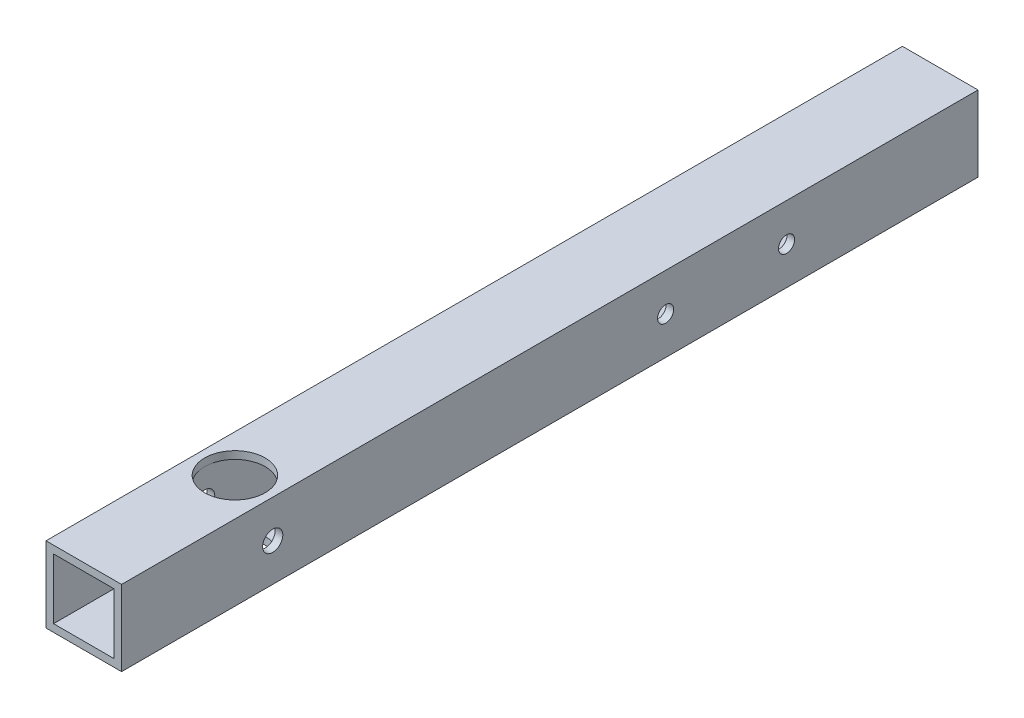
from build123d import *

# Parameters (mm, degrees)
SKETCH_1_W               = 15
SKETCH_1_H               = 15
SKETCH_1_W_2             = 12
SKETCH_1_H_2             = 12
EXTRUDE_1_DEPTH          = 160
SKETCH_3_R               = 6
CUT_EXTRUDE_3_DEPTH      = 161.876505432
SKETCH_7_R               = 2
CUT_EXTRUDE_4_DEPTH      = 161.876505432
CUT_EXTRUDE_5_DEPTH      = 161.876505432
CUT_EXTRUDE_5_DEPTH_BACK = 161.876505432
SKETCH_12_R              = 1.6
SKETCH_13_W              = 15
SKETCH_13_H              = 15
SKETCH_13_W_2            = 12
SKETCH_13_H_2            = 12
EXTRUDE_1_2_DEPTH        = 10


with BuildPart() as part:
    # ｽｹｯﾁ1 → Extrude 1 (new body)
    with BuildSketch(Plane.XY):
        Rectangle(SKETCH_1_W, SKETCH_1_H)
        Rectangle(SKETCH_1_W_2, SKETCH_1_H_2, mode=Mode.SUBTRACT)
    extrude(amount=EXTRUDE_1_DEPTH)

    # ｽｹｯﾁ3 → ｶｯﾄ - 押し出し3 (cut, through all)
    with BuildSketch(Plane.XZ.offset(7.5)):
        with Locations(Location((0, 140, 0), (0, 0, 180))):
            Circle(SKETCH_3_R)
    extrude(amount=-CUT_EXTRUDE_3_DEPTH, mode=Mode.SUBTRACT)

    # ｽｹｯﾁ7 → ｶｯﾄ - 押し出し4 (cut, through all)
    with BuildSketch(Plane.ZY.offset(7.5)):
        with Locations((140, 0)):
            Circle(SKETCH_7_R)
    extrude(amount=-CUT_EXTRUDE_4_DEPTH, mode=Mode.SUBTRACT)

    # ｽｹｯﾁ12 → ｶｯﾄ - 押し出し5 (cut, two sides: drawn at the far end of the back side and taken through both)
    with BuildSketch(Plane(origin=(7.5, 0, 0), x_dir=(0, 0, -1), z_dir=(1, 0, 0)).offset(-CUT_EXTRUDE_5_DEPTH_BACK)):
        with Locations((-38, 0)):
            Circle(SKETCH_12_R)
        with Locations((-62, 0)):
            Circle(SKETCH_12_R)
    extrude(amount=CUT_EXTRUDE_5_DEPTH + CUT_EXTRUDE_5_DEPTH_BACK, mode=Mode.SUBTRACT)

    # ｽｹｯﾁ13 → Extrude 1 2 (add)
    with BuildSketch(Plane.XY.offset(160)):
        Rectangle(SKETCH_13_W, SKETCH_13_H)
        Rectangle(SKETCH_13_W_2, SKETCH_13_H_2, mode=Mode.SUBTRACT)
    extrude(amount=EXTRUDE_1_2_DEPTH)


solid = part.part
